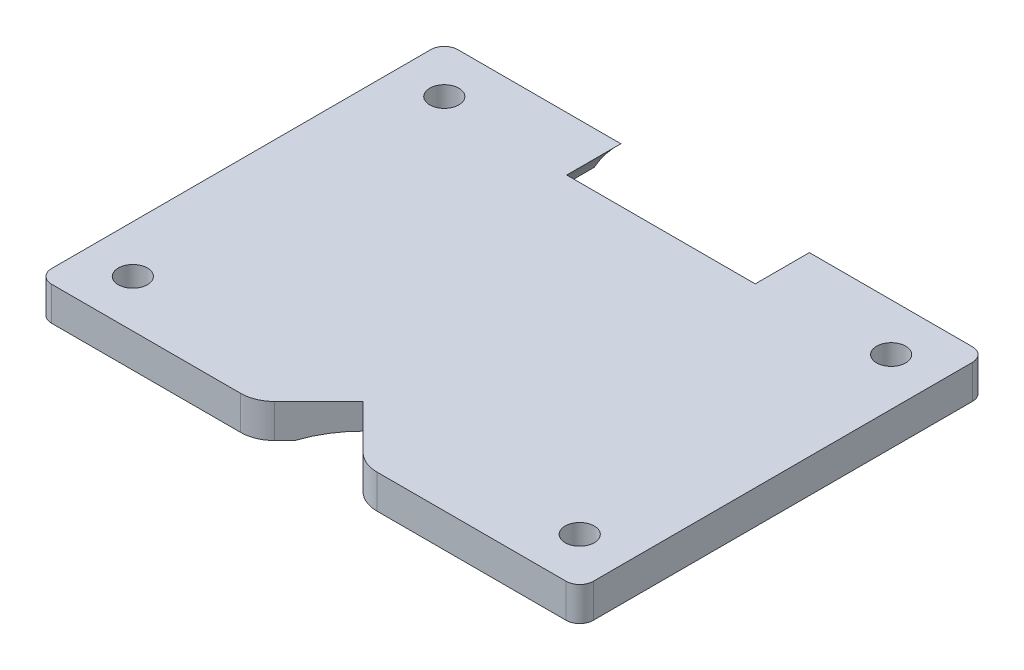
from build123d import *

# Parameters (mm, degrees)
SKETCH1_R           = 11.25
BOSS_EXTRUDE1_DEPTH = 60
SKETCH6_R           = 2.15
CUT_EXTRUDE5_DEPTH  = 77.321687612
CUT_EXTRUDE6_START  = -25
CUT_EXTRUDE6_DEPTH  = 25
FILLET3_R           = 2
CUT_EXTRUDE7_DEPTH  = 79.102496759
FILLET5_R           = 5
SKETCH9_R           = 20.5
CUT_EXTRUDE8_DEPTH  = 8
SKETCH10_R          = 11.25
BOSS_EXTRUDE2_DEPTH = 8
SKETCH12_R          = 1.65
CUT_EXTRUDE9_DEPTH  = 14
FILLET7_R           = 5
FILLET8_R           = 3


with BuildPart() as part:
    # Sketch1 → Boss-Extrude1 (new body)
    with BuildSketch(Plane.XY):
        with BuildLine():
            Line((-40, 15.05), (40, 15.05))
            Line((40, 15.05), (40, 10.05))
            Line((40, 10.05), (14.933100817, 10.05))
            ThreePointArc((14.933100817, 10.05), (17.662807084, -3.467743633), (10.024844138, -14.95))
            Line((10.024844138, -14.95), (-10.024844138, -14.95))
            ThreePointArc((-10.024844138, -14.95), (-17.662807084, -3.467743633), (-14.933100817, 10.05))
            Line((-14.933100817, 10.05), (-40, 10.05))
            Line((-40, 10.05), (-40, 15.05))
        make_face()
        with Locations(Location((0, 0, 0), (0, 0, 180))):
            Circle(SKETCH1_R, mode=Mode.SUBTRACT)
    extrude(amount=BOSS_EXTRUDE1_DEPTH)

    # Sketch6 → Cut-Extrude5 (cut, through all)
    with BuildSketch(Plane(origin=(0, 10.05, 0), x_dir=(-1, 0, 0), z_dir=(0, -1, 0))):
        with Locations(Location((33, -53, 0), (0, 0, 90))):
            Circle(SKETCH6_R)
        with Locations(Location((33, -7, 0), (0, 0, 90))):
            Circle(SKETCH6_R)
        with Locations(Location((-33, -53, 0), (0, 0, 90))):
            Circle(SKETCH6_R)
        with Locations(Location((-33, -7, 0), (0, 0, 90))):
            Circle(SKETCH6_R)
    extrude(amount=-CUT_EXTRUDE5_DEPTH, mode=Mode.SUBTRACT)

    # Sketch7 → Cut-Extrude6 (cut)
    with BuildSketch(Plane.XY.offset(60).offset(CUT_EXTRUDE6_START)):
        with BuildLine():
            Line((-14.933100817, 10.05), (14.933100817, 10.05))
            ThreePointArc((14.933100817, 10.05), (0, -18), (-14.933100817, 10.05))
        make_face()
    extrude(amount=CUT_EXTRUDE6_DEPTH, mode=Mode.SUBTRACT)

    # Fillet3
    fillet3_edges = [part.edges().sort_by_distance(p)[0] for p in [
        (-40, 12.55, 0),
        (40, 12.55, 60),
        (-40, 12.55, 60),
        (40, 12.55, 0),
    ]]
    fillet(fillet3_edges, radius=FILLET3_R)

    # Sketch8 → Cut-Extrude7 (cut, through all)
    with BuildSketch(Plane(origin=(0, 15.05, 0), x_dir=(1, 0, 0), z_dir=(0, 1, 0))):
        Polygon((0, -52), (8, -60), (-8, -60), align=None)
    extrude(amount=-CUT_EXTRUDE7_DEPTH, mode=Mode.SUBTRACT)

    # Fillet5
    fillet5_edges = [part.edges().sort_by_distance(p)[0] for p in [
        (-8, 12.55, 60),
        (8, 12.55, 60),
    ]]
    fillet(fillet5_edges, radius=FILLET5_R)

    # Sketch9 → Cut-Extrude8 (cut)
    with BuildSketch(Plane(origin=(0, 0, 0), x_dir=(-1, 0, 0), z_dir=(0, 0, -1))):
        Circle(SKETCH9_R)
    extrude(amount=-CUT_EXTRUDE8_DEPTH, mode=Mode.SUBTRACT)

    # Sketch10 → Boss-Extrude2 (add)
    with BuildSketch(Plane(origin=(0, 0, 8), x_dir=(-1, 0, 0), z_dir=(0, 0, -1))):
        with BuildLine():
            Line((-13.919321104, 15.05), (13.919321104, 15.05))
            ThreePointArc((13.919321104, 15.05), (20.499868756, 0.073355309), (14.026671023, -14.95))
            Line((14.026671023, -14.95), (-14.026671023, -14.95))
            ThreePointArc((-14.026671023, -14.95), (-20.499868756, 0.073355309), (-13.919321104, 15.05))
        make_face()
        Circle(SKETCH10_R, mode=Mode.SUBTRACT)
    extrude(amount=-BOSS_EXTRUDE2_DEPTH)

    # Sketch12 → Cut-Extrude9 (cut)
    with BuildSketch(Plane(origin=(0, 0, 8), x_dir=(-1, 0, 0), z_dir=(0, 0, -1))):
        with Locations((-16, 0)):
            Circle(SKETCH12_R)
        with Locations((-11.313708499, 11.313708499)):
            Circle(SKETCH12_R)
        with Locations((-11.313708499, -11.313708499)):
            Circle(SKETCH12_R)
        with Locations((11.313708499, -11.313708499)):
            Circle(SKETCH12_R)
        with Locations((16, 0)):
            Circle(SKETCH12_R)
        with Locations((11.313708499, 11.313708499)):
            Circle(SKETCH12_R)
    extrude(amount=-CUT_EXTRUDE9_DEPTH, mode=Mode.SUBTRACT)

    # Fillet7
    fillet7_edges = [part.edges().sort_by_distance(p)[0] for p in [
        (-17.867498426, 10.05, 12),
        (17.867498426, 10.05, 12),
    ]]
    fillet(fillet7_edges, radius=FILLET7_R)

    # Fillet8
    fillet8_edges = [part.edges().sort_by_distance(p)[0] for p in [
        (14.933100817, 10.05, 25.5),
        (-14.933100817, 10.05, 25.5),
    ]]
    fillet(fillet8_edges, radius=FILLET8_R)


solid = part.part
